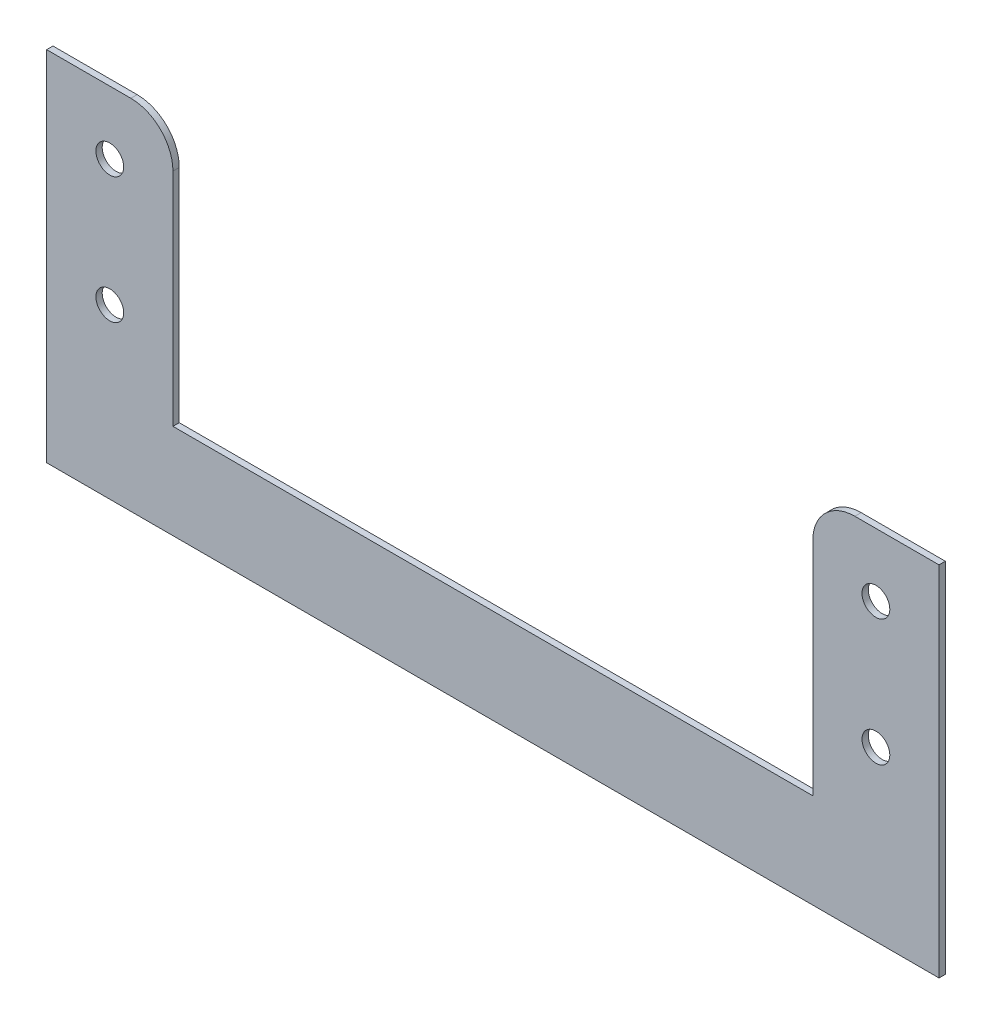
from build123d import *

# Parameters (mm, degrees)
SKETCH_1_R      = 6.6
EXTRUDE_1_DEPTH = 3
FILLET_1_R      = 20


with BuildPart() as part:
    # Эскиз1 → Бобышка-Вытянуть1 (new body)
    with BuildSketch(Plane.XY):
        Polygon((152, 0), (-152, 0), (-152, 125), (-212, 125), (-212, -45), (212, -45), (212, 125), (152, 125), align=None)
        with Locations((-182, 95)):
            Circle(SKETCH_1_R, mode=Mode.SUBTRACT)
        with Locations((-182, 35)):
            Circle(SKETCH_1_R, mode=Mode.SUBTRACT)
        with Locations(Location((182, 35, 0), (0, 0, 180))):
            Circle(SKETCH_1_R, mode=Mode.SUBTRACT)
        with Locations(Location((182, 95, 0), (0, 0, 180))):
            Circle(SKETCH_1_R, mode=Mode.SUBTRACT)
    extrude(amount=EXTRUDE_1_DEPTH)

    # Скругление1
    fillet_1_edges = [part.edges().sort_by_distance(p)[0] for p in [
        (-152, 125, 1.5),
        (152, 125, 1.5),
    ]]
    fillet(fillet_1_edges, radius=FILLET_1_R)


solid = part.part
